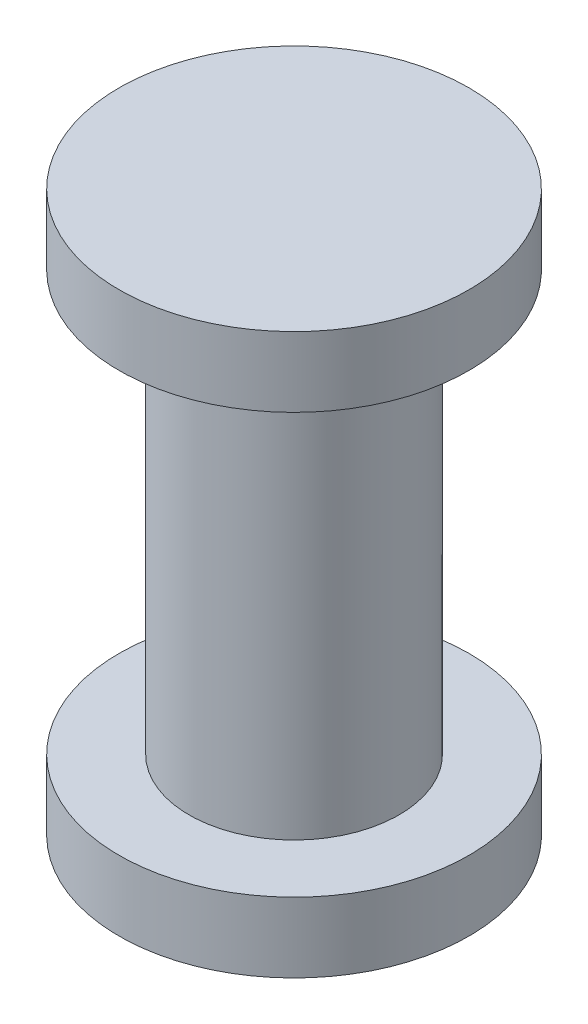
from build123d import *


with BuildPart() as part:
    # Sketch1 → Revolve1 (revolve)
    with BuildSketch(Plane.XY, mode=Mode.PRIVATE) as revolve1_sk:
        Polygon((0, 0), (0, 8), (-2.5, 8), (-2.5, 7), (-1.5, 7), (-1.5, 1), (-2.5, 1), (-2.5, 0), align=None)
    revolve(revolve1_sk.sketch.rotate(Axis((0, 0, 0), (0, 1, 0)), 270), axis=Axis((0, 0, 0), (0, 1, 0)))


solid = part.part
